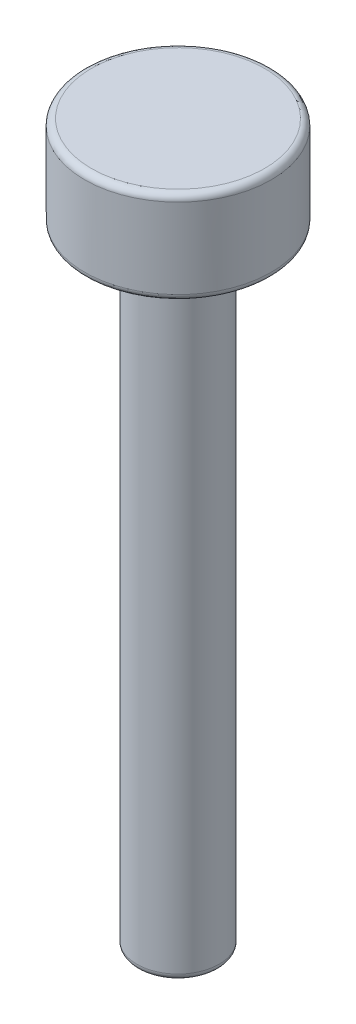
from build123d import *

# Parameters (mm, degrees)
FILLET1_R = 0.762


with BuildPart() as part:
    # Sketch1 → Revolve1 (revolve)
    with BuildSketch(Plane.XY, mode=Mode.PRIVATE) as revolve1_sk:
        Polygon((0, 0), (4.7625, 0), (4.7625, 72.39), (10.795, 72.39), (10.795, 83.185), (0, 83.185), align=None)
    revolve(revolve1_sk.sketch.rotate(Axis((0, 0, 0), (0, 1, 0)), 90), axis=Axis((0, 0, 0), (0, 1, 0)))

    # Fillet1
    fillet1_edges = [part.edges().sort_by_distance(p)[0] for p in [
        (0, 83.185, 10.795),
        (0, 72.39, 10.795),
        (0, 0, 4.7625),
    ]]
    fillet(fillet1_edges, radius=FILLET1_R)


solid = part.part
